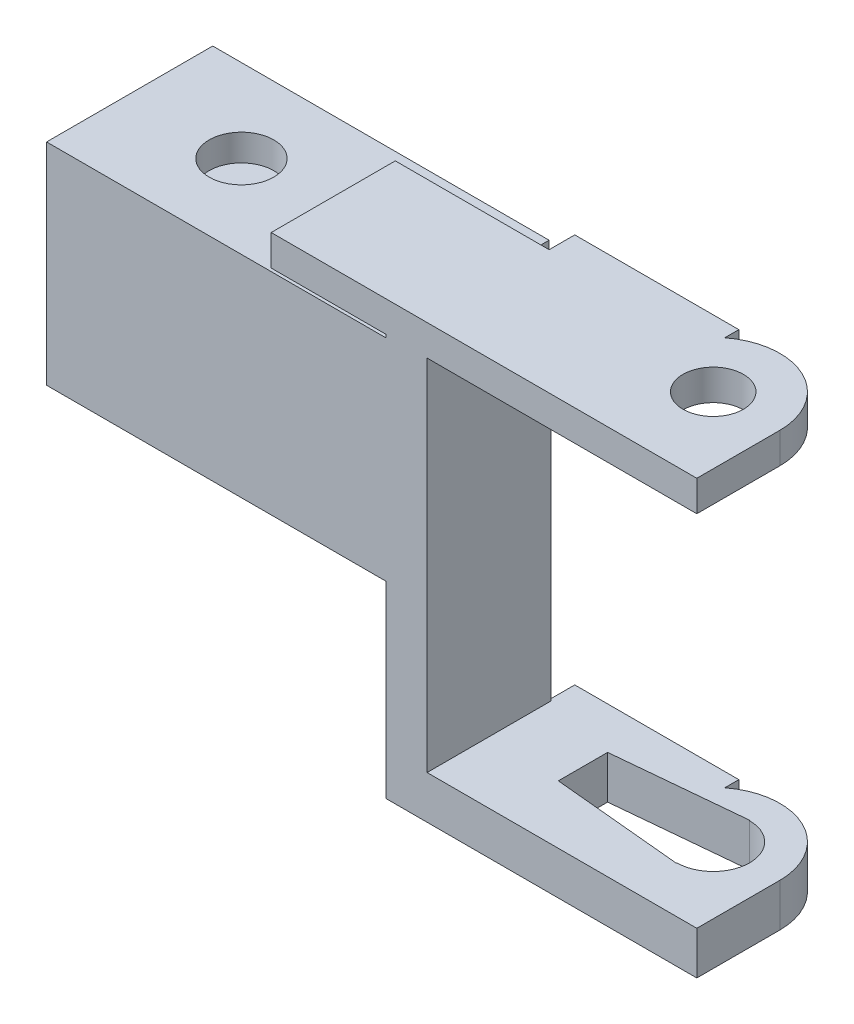
from build123d import *

# Parameters (mm, degrees)
BOSS_EXTRUDE1_START  = -17.075
SKETCH1_W            = 32.8
SKETCH1_H            = 16.2
BOSS_EXTRUDE1_DEPTH  = 10.275
BOSS_EXTRUDE2_START  = -5
SKETCH2_W            = 31
SKETCH2_H            = 12.1
BOSS_EXTRUDE2_DEPTH  = 1.5
BOSS_EXTRUDE3_START  = -5
SKETCH3_W            = 16
SKETCH3_H            = 14.6
BOSS_EXTRUDE3_DEPTH  = 1.5
BOSS_EXTRUDE4_START  = -5
SKETCH4_W            = 10.5
SKETCH4_H            = 8.1
BOSS_EXTRUDE4_DEPTH  = 1.5
BOSS_EXTRUDE5_START  = -5
SKETCH5_R            = 6.5
BOSS_EXTRUDE5_DEPTH  = 1.5
CUT_EXTRUDE1_START   = -5
SKETCH6_R            = 2.95
CUT_EXTRUDE1_DEPTH   = 1.5
BOSS_EXTRUDE6_START  = 70.2
SKETCH7_W            = 12.1
SKETCH7_H            = 42.2
BOSS_EXTRUDE6_DEPTH  = 2
BOSS_EXTRUDE7_START  = 68.05
SKETCH8_W            = 12.1
SKETCH8_H            = 20.55
BOSS_EXTRUDE7_DEPTH  = 1.15
BOSS_EXTRUDE8_START  = -43.6
SKETCH9_W            = 19.8
SKETCH9_H            = 12.1
BOSS_EXTRUDE8_DEPTH  = 2.1
BOSS_EXTRUDE9_START  = -43.6
SKETCH10_W           = 16
SKETCH10_H           = 14.6
BOSS_EXTRUDE9_DEPTH  = 2.1
BOSS_EXTRUDE10_START = -43.6
SKETCH11_W           = 10.5
SKETCH11_H           = 8.1
BOSS_EXTRUDE10_DEPTH = 2.1
BOSS_EXTRUDE11_START = -43.6
SKETCH12_R           = 6.5
BOSS_EXTRUDE11_DEPTH = 2.1
CUT_EXTRUDE2_START   = -43.6
SKETCH13_R           = 3.55
CUT_EXTRUDE2_DEPTH   = 2.1
CUT_EXTRUDE3_START   = -43.6
CUT_EXTRUDE3_DEPTH   = 2.1
CUT_EXTRUDE4_START   = -18.725
SKETCH15_W           = 23.2
SKETCH15_H           = 13
CUT_EXTRUDE4_DEPTH   = 8.625
CUT_EXTRUDE5_START   = -24.35
SKETCH16_R           = 1
CUT_EXTRUDE5_DEPTH   = 3
CUT_EXTRUDE6_START   = -24.35
SKETCH17_R           = 1
CUT_EXTRUDE6_DEPTH   = 3
CUT_EXTRUDE7_START   = -8.1
SKETCH18_R           = 3.15
CUT_EXTRUDE7_DEPTH   = 1.3
CUT_EXTRUDE8_START   = 37.5
SKETCH19_W           = 4.4
SKETCH19_H           = 6
CUT_EXTRUDE8_DEPTH   = 2.4


with BuildPart() as part:
    # Sketch1 → Boss-Extrude1 (new, symmetric)
    with BuildSketch(Plane(origin=(0, 0, 0), x_dir=(1, 0, 0), z_dir=(0, 1, 0)).offset(BOSS_EXTRUDE1_START)):
        with Locations((51.5, 0)):
            Rectangle(SKETCH1_W, SKETCH1_H)
    extrude(amount=BOSS_EXTRUDE1_DEPTH, both=True)



with BuildPart() as body_2:
    # Sketch2 → Boss-Extrude2 (new, symmetric)
    with BuildSketch(Plane(origin=(0, 0, 0), x_dir=(1, 0, 0), z_dir=(0, 1, 0)).offset(BOSS_EXTRUDE2_START)):
        with Locations((72.5, -2.05)):
            Rectangle(SKETCH2_W, SKETCH2_H)
    extrude(amount=BOSS_EXTRUDE2_DEPTH, both=True)

    # Sketch3 → Boss-Extrude3 (add, symmetric)
    with BuildSketch(Plane(origin=(0, 0, 0), x_dir=(1, 0, 0), z_dir=(0, 1, 0)).offset(BOSS_EXTRUDE3_START)):
        with Locations((80, -0.8)):
            Rectangle(SKETCH3_W, SKETCH3_H)
    extrude(amount=BOSS_EXTRUDE3_DEPTH, both=True)

    # Sketch4 → Boss-Extrude4 (add, symmetric)
    with BuildSketch(Plane(origin=(0, 0, 0), x_dir=(1, 0, 0), z_dir=(0, 1, 0)).offset(BOSS_EXTRUDE4_START)):
        with Locations((93.25, -4.05)):
            Rectangle(SKETCH4_W, SKETCH4_H)
    extrude(amount=BOSS_EXTRUDE4_DEPTH, both=True)

    # Sketch5 → Boss-Extrude5 (add, symmetric)
    with BuildSketch(Plane(origin=(0, 0, 0), x_dir=(1, 0, 0), z_dir=(0, 1, 0)).offset(BOSS_EXTRUDE5_START)):
        with Locations((92, 0)):
            Circle(SKETCH5_R)
    extrude(amount=BOSS_EXTRUDE5_DEPTH, both=True)

    # Sketch6 → Cut-Extrude1 (cut, symmetric)
    with BuildSketch(Plane(origin=(0, 0, 0), x_dir=(1, 0, 0), z_dir=(0, 1, 0)).offset(CUT_EXTRUDE1_START)):
        with Locations(Location((92, 0, 0), (0, 0, 270))):
            Circle(SKETCH6_R)
    extrude(amount=CUT_EXTRUDE1_DEPTH, both=True, mode=Mode.SUBTRACT)

    # Sketch7 → Boss-Extrude6 (add, symmetric)
    with BuildSketch(Plane(origin=(0, 0, 0), x_dir=(0, 0, -1), z_dir=(1, 0, 0)).offset(BOSS_EXTRUDE6_START)):
        with Locations((-2.05, -24.6)):
            Rectangle(SKETCH7_W, SKETCH7_H)
    extrude(amount=BOSS_EXTRUDE6_DEPTH, both=True)


with BuildPart() as part_1:
    add(part.part)

    add(body_2.part)  # Boss-Extrude7 merges body 2
    # Sketch8 → Boss-Extrude7 (add, symmetric)
    with BuildSketch(Plane(origin=(0, 0, 0), x_dir=(0, 0, -1), z_dir=(1, 0, 0)).offset(BOSS_EXTRUDE7_START)):
        with Locations((-2.05, -17.075)):
            Rectangle(SKETCH8_W, SKETCH8_H)
    extrude(amount=BOSS_EXTRUDE7_DEPTH, both=True)

    # Sketch9 → Boss-Extrude8 (add, symmetric)
    with BuildSketch(Plane(origin=(0, 0, 0), x_dir=(1, 0, 0), z_dir=(0, 1, 0)).offset(BOSS_EXTRUDE8_START)):
        with Locations((78.1, -2.05)):
            Rectangle(SKETCH9_W, SKETCH9_H)
    extrude(amount=BOSS_EXTRUDE8_DEPTH, both=True)

    # Sketch10 → Boss-Extrude9 (add, symmetric)
    with BuildSketch(Plane(origin=(0, 0, 0), x_dir=(1, 0, 0), z_dir=(0, 1, 0)).offset(BOSS_EXTRUDE9_START)):
        with Locations((80, -0.8)):
            Rectangle(SKETCH10_W, SKETCH10_H)
    extrude(amount=BOSS_EXTRUDE9_DEPTH, both=True)

    # Sketch11 → Boss-Extrude10 (add, symmetric)
    with BuildSketch(Plane(origin=(0, 0, 0), x_dir=(1, 0, 0), z_dir=(0, 1, 0)).offset(BOSS_EXTRUDE10_START)):
        with Locations((93.25, -4.05)):
            Rectangle(SKETCH11_W, SKETCH11_H)
    extrude(amount=BOSS_EXTRUDE10_DEPTH, both=True)

    # Sketch12 → Boss-Extrude11 (add, symmetric)
    with BuildSketch(Plane(origin=(0, 0, 0), x_dir=(1, 0, 0), z_dir=(0, 1, 0)).offset(BOSS_EXTRUDE11_START)):
        with Locations((92, 0)):
            Circle(SKETCH12_R)
    extrude(amount=BOSS_EXTRUDE11_DEPTH, both=True)

    # Sketch13 → Cut-Extrude2 (cut, symmetric)
    with BuildSketch(Plane(origin=(0, 0, 0), x_dir=(1, 0, 0), z_dir=(0, 1, 0)).offset(CUT_EXTRUDE2_START)):
        with Locations(Location((92, 0, 0), (0, 0, 270))):
            Circle(SKETCH13_R)
    extrude(amount=CUT_EXTRUDE2_DEPTH, both=True, mode=Mode.SUBTRACT)

    # Sketch14 → Cut-Extrude3 (cut, symmetric)
    with BuildSketch(Plane(origin=(0, 0, 0), x_dir=(1, 0, 0), z_dir=(0, 1, 0)).offset(CUT_EXTRUDE3_START)):
        Polygon((92, 3.603784861), (79.3, 2.403281405), (79.3, -2.403281405), (92, -3.603784861), align=None)
    extrude(amount=CUT_EXTRUDE3_DEPTH, both=True, mode=Mode.SUBTRACT)

    # Sketch15 → Cut-Extrude4 (cut, symmetric)
    with BuildSketch(Plane(origin=(0, 0, 0), x_dir=(1, 0, 0), z_dir=(0, 1, 0)).offset(CUT_EXTRUDE4_START)):
        with Locations((51.5, 0)):
            Rectangle(SKETCH15_W, SKETCH15_H)
    extrude(amount=CUT_EXTRUDE4_DEPTH, both=True, mode=Mode.SUBTRACT)

    # Sketch16 → Cut-Extrude5 (cut, symmetric)
    with BuildSketch(Plane(origin=(0, 0, 0), x_dir=(1, 0, 0), z_dir=(0, 1, 0)).offset(CUT_EXTRUDE5_START)):
        with Locations(Location((65.25, 0, 0), (0, 0, 270))):
            Circle(SKETCH16_R)
    extrude(amount=CUT_EXTRUDE5_DEPTH, both=True, mode=Mode.SUBTRACT)

    # Sketch17 → Cut-Extrude6 (cut, symmetric)
    with BuildSketch(Plane(origin=(0, 0, 0), x_dir=(1, 0, 0), z_dir=(0, 1, 0)).offset(CUT_EXTRUDE6_START)):
        with Locations(Location((37.75, 0, 0), (0, 0, 270))):
            Circle(SKETCH17_R)
    extrude(amount=CUT_EXTRUDE6_DEPTH, both=True, mode=Mode.SUBTRACT)

    # Sketch18 → Cut-Extrude7 (cut, symmetric)
    with BuildSketch(Plane(origin=(0, 0, 0), x_dir=(1, 0, 0), z_dir=(0, 1, 0)).offset(CUT_EXTRUDE7_START)):
        with Locations(Location((46, 0, 0), (0, 0, 270))):
            Circle(SKETCH18_R)
    extrude(amount=CUT_EXTRUDE7_DEPTH, both=True, mode=Mode.SUBTRACT)

    # Sketch19 → Cut-Extrude8 (cut, symmetric)
    with BuildSketch(Plane(origin=(0, 0, 0), x_dir=(0, 0, -1), z_dir=(1, 0, 0)).offset(CUT_EXTRUDE8_START)):
        with Locations((0, -13.1)):
            Rectangle(SKETCH19_W, SKETCH19_H)
    extrude(amount=CUT_EXTRUDE8_DEPTH, both=True, mode=Mode.SUBTRACT)


solid = part_1.part
